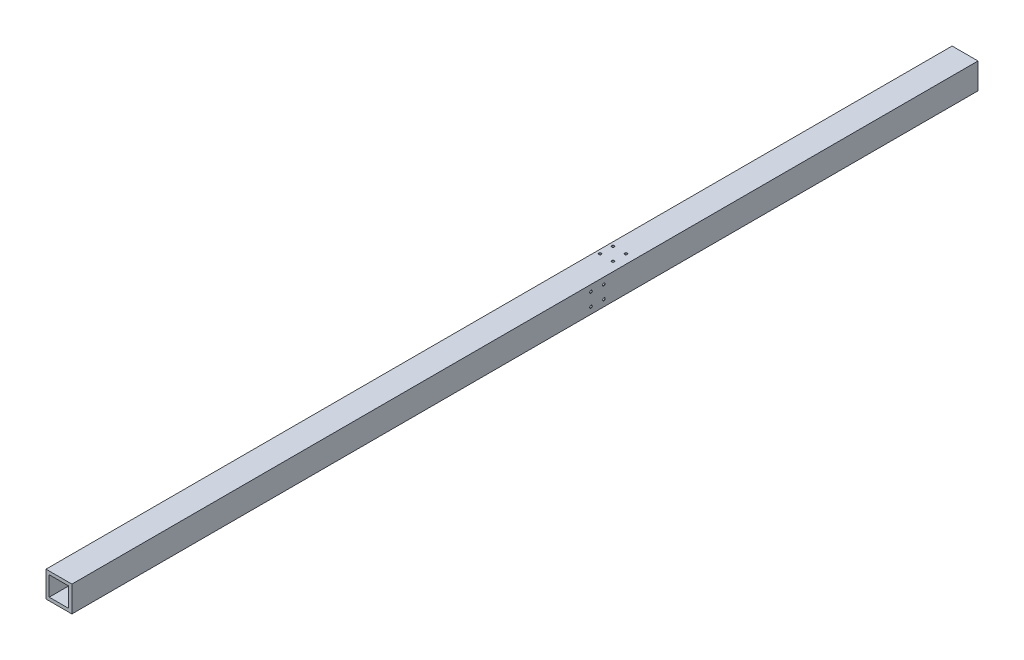
from build123d import *

# Parameters (mm, degrees)
SKETCH_1_W                  = 40
SKETCH_1_H                  = 40
SKETCH_1_W_2                = 30
SKETCH_1_H_2                = 30
EXTRUDE_1_DEPTH             = 1400
HOLE_WIZARD_M41_D           = 3.3
HOLE_WIZARD_M41_DEPTH       = 11.5
HOLE_WIZARD_M41_CSINK_D     = 4.05
HOLE_WIZARD_M41_CSINK_ANGLE = 120
HOLE_WIZARD_M41_TIP         = 0.991420021
HOLE_WIZARD_M42_D           = 3.3
HOLE_WIZARD_M42_DEPTH       = 11.5
HOLE_WIZARD_M42_CSINK_D     = 4.05
HOLE_WIZARD_M42_CSINK_ANGLE = 120
HOLE_WIZARD_M42_TIP         = 0.991420021
HOLE_WIZARD_M43_D           = 3.3
HOLE_WIZARD_M43_DEPTH       = 11.5
HOLE_WIZARD_M43_CSINK_D     = 4.05
HOLE_WIZARD_M43_CSINK_ANGLE = 120
HOLE_WIZARD_M43_TIP         = 0.991420021
HOLE_WIZARD_M44_D           = 3.3
HOLE_WIZARD_M44_DEPTH       = 11.5
HOLE_WIZARD_M44_CSINK_D     = 4.05
HOLE_WIZARD_M44_CSINK_ANGLE = 120
HOLE_WIZARD_M44_TIP         = 0.991420021


with BuildPart() as part:
    # Эскиз1 → Вытянуть-Тонкостенный1 (new body)
    with BuildSketch(Plane.XY):
        with Locations((20, 20)):
            Rectangle(SKETCH_1_W, SKETCH_1_H)
        with Locations((20, 20)):
            Rectangle(SKETCH_1_W_2, SKETCH_1_H_2, mode=Mode.SUBTRACT)
    extrude(amount=EXTRUDE_1_DEPTH)

    # Отверстие обработанное метчиком M41
    with Locations(Plane.ZY):
        with Locations((1030, 30), (1010, 30), (1030, 10), (1010, 10)):
            CounterSinkHole(HOLE_WIZARD_M41_D / 2, HOLE_WIZARD_M41_CSINK_D / 2, depth=HOLE_WIZARD_M41_DEPTH, counter_sink_angle=HOLE_WIZARD_M41_CSINK_ANGLE)
            with Locations((0, 0, -(HOLE_WIZARD_M41_DEPTH + HOLE_WIZARD_M41_TIP / 2))):  # 118° drill point
                Cone(0, HOLE_WIZARD_M41_D / 2, HOLE_WIZARD_M41_TIP, mode=Mode.SUBTRACT)

    # Отверстие обработанное метчиком M42
    with Locations(Plane(origin=(40, 0, 0), x_dir=(0, 0, -1), z_dir=(1, 0, 0))):
        with Locations((-598, 30), (-578, 30), (-598, 10), (-578, 10)):
            CounterSinkHole(HOLE_WIZARD_M42_D / 2, HOLE_WIZARD_M42_CSINK_D / 2, depth=HOLE_WIZARD_M42_DEPTH, counter_sink_angle=HOLE_WIZARD_M42_CSINK_ANGLE)
            with Locations((0, 0, -(HOLE_WIZARD_M42_DEPTH + HOLE_WIZARD_M42_TIP / 2))):  # 118° drill point
                Cone(0, HOLE_WIZARD_M42_D / 2, HOLE_WIZARD_M42_TIP, mode=Mode.SUBTRACT)

    # Отверстие обработанное метчиком M43
    with Locations(Plane.XZ):
        with Locations((30, 1030), (10, 1030), (30, 1010), (10, 1010)):
            CounterSinkHole(HOLE_WIZARD_M43_D / 2, HOLE_WIZARD_M43_CSINK_D / 2, depth=HOLE_WIZARD_M43_DEPTH, counter_sink_angle=HOLE_WIZARD_M43_CSINK_ANGLE)
            with Locations((0, 0, -(HOLE_WIZARD_M43_DEPTH + HOLE_WIZARD_M43_TIP / 2))):  # 118° drill point
                Cone(0, HOLE_WIZARD_M43_D / 2, HOLE_WIZARD_M43_TIP, mode=Mode.SUBTRACT)

    # Отверстие обработанное метчиком M44
    with Locations(Plane(origin=(0, 40, 0), x_dir=(-1, 0, 0), z_dir=(0, 1, 0))):
        with Locations((-6, 550), (-26, 550), (-6, 530), (-26, 530)):
            CounterSinkHole(HOLE_WIZARD_M44_D / 2, HOLE_WIZARD_M44_CSINK_D / 2, depth=HOLE_WIZARD_M44_DEPTH, counter_sink_angle=HOLE_WIZARD_M44_CSINK_ANGLE)
            with Locations((0, 0, -(HOLE_WIZARD_M44_DEPTH + HOLE_WIZARD_M44_TIP / 2))):  # 118° drill point
                Cone(0, HOLE_WIZARD_M44_D / 2, HOLE_WIZARD_M44_TIP, mode=Mode.SUBTRACT)


solid = part.part
